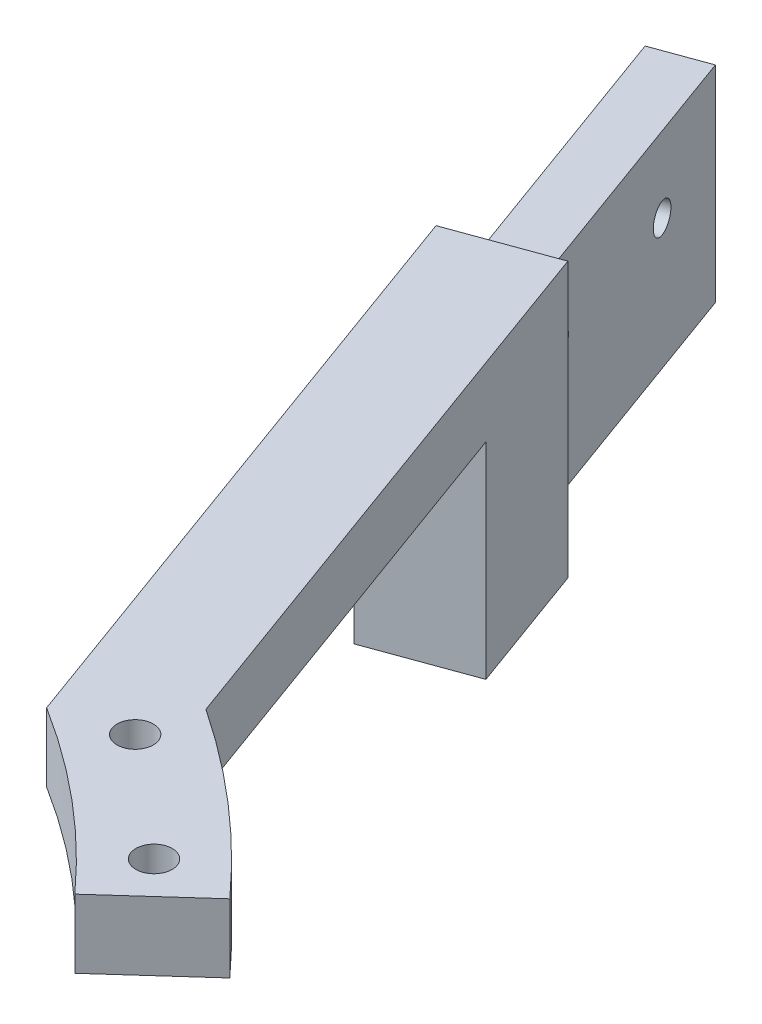
from build123d import *

# Parameters (mm, degrees)
SKETCH_1_R          = 2.65
EXTRUDE_3_DEPTH     = 10
EXTRUDE_4_DEPTH     = 30
SKETCH_15_W         = 15
SKETCH_15_H         = 30
EXTRUDE_5_DEPTH     = 51
SKETCH_16_R         = 2.15
CUT_EXTRUDE_6_DEPTH = 228.080726912
SKETCH_17_W         = 51
SKETCH_17_H         = 30
CUT_EXTRUDE_7_DEPTH = 7


with BuildPart() as part:
    # 草图1 → 凸台-拉伸3 (new body)
    with BuildSketch(Plane(origin=(0, 0, 0), x_dir=(1, 0, 0), z_dir=(0, 1, 0))):
        with BuildLine():
            Line((31.098398092, 191.036570513), (63.590311708, 101.765771539))
            ThreePointArc((63.590311708, 101.765771539), (77.134513162, 91.925333174), (89.177379057, 80.295672763))
            Line((89.177379057, 80.295672763), (101.067696265, 91.001762465))
            ThreePointArc((101.067696265, 91.001762465), (88.926297254, 102.898560033), (75.395677923, 113.187860438))
            Line((75.395677923, 113.187860438), (45.193787404, 196.166872663))
            Line((45.193787404, 196.166872663), (31.098398092, 191.036570513))
        make_face()
        with Locations(Location((73.417783853, 104.851461669, 0), (0, 0, 270))):
            Circle(SKETCH_1_R, mode=Mode.SUBTRACT)
        with Locations(Location((90.509667992, 90.509667992, 0), (0, 0, 270))):
            Circle(SKETCH_1_R, mode=Mode.SUBTRACT)
    extrude(amount=EXTRUDE_3_DEPTH)

    # 草图14 → 凸台-拉伸4 (add)
    with BuildSketch(Plane.XZ):
        Polygon((45.193787404, -196.166872663), (31.098398092, -191.036570513), (37.938800959, -172.242718098), (52.03419027, -177.373020248), align=None)
    extrude(amount=EXTRUDE_4_DEPTH)


with BuildPart() as body_2:
    # 草图15 → 凸台-拉伸5 (new body)
    with BuildSketch(Plane(origin=(-57.76014874, 0, -158.694704407), x_dir=(-0.9396926207859112, 0, 0.3420201433256609), z_dir=(-0.3420201433256609, 0, -0.9396926207859113))):
        with Locations((-102.061290433, -15)):
            Rectangle(SKETCH_15_W, SKETCH_15_H)
    extrude(amount=EXTRUDE_5_DEPTH)

    # 草图16 → 切除-拉伸6 (cut, through all)
    with BuildSketch(Plane(origin=(102.953936143, 0, -37.472168257), x_dir=(-0.34202014332566083, 0, -0.9396926207859113), z_dir=(0.9396926207859113, 0, -0.34202014332566083))):
        with Locations((206.879377039, -11)):
            Circle(SKETCH_16_R)
        with Locations((181.879377039, -11)):
            Circle(SKETCH_16_R)
    extrude(amount=-CUT_EXTRUDE_6_DEPTH, mode=Mode.SUBTRACT)

    # 草图17 → 切除-拉伸7 (cut)
    with BuildSketch(Plane(origin=(102.953936143, 0, -37.472168257), x_dir=(-0.34202014332566083, 0, -0.9396926207859113), z_dir=(0.9396926207859113, 0, -0.34202014332566083))):
        with Locations((194.379377039, -15)):
            Rectangle(SKETCH_17_W, SKETCH_17_H)
    extrude(amount=-CUT_EXTRUDE_7_DEPTH, mode=Mode.SUBTRACT)


solid = Compound([part.part, body_2.part])
